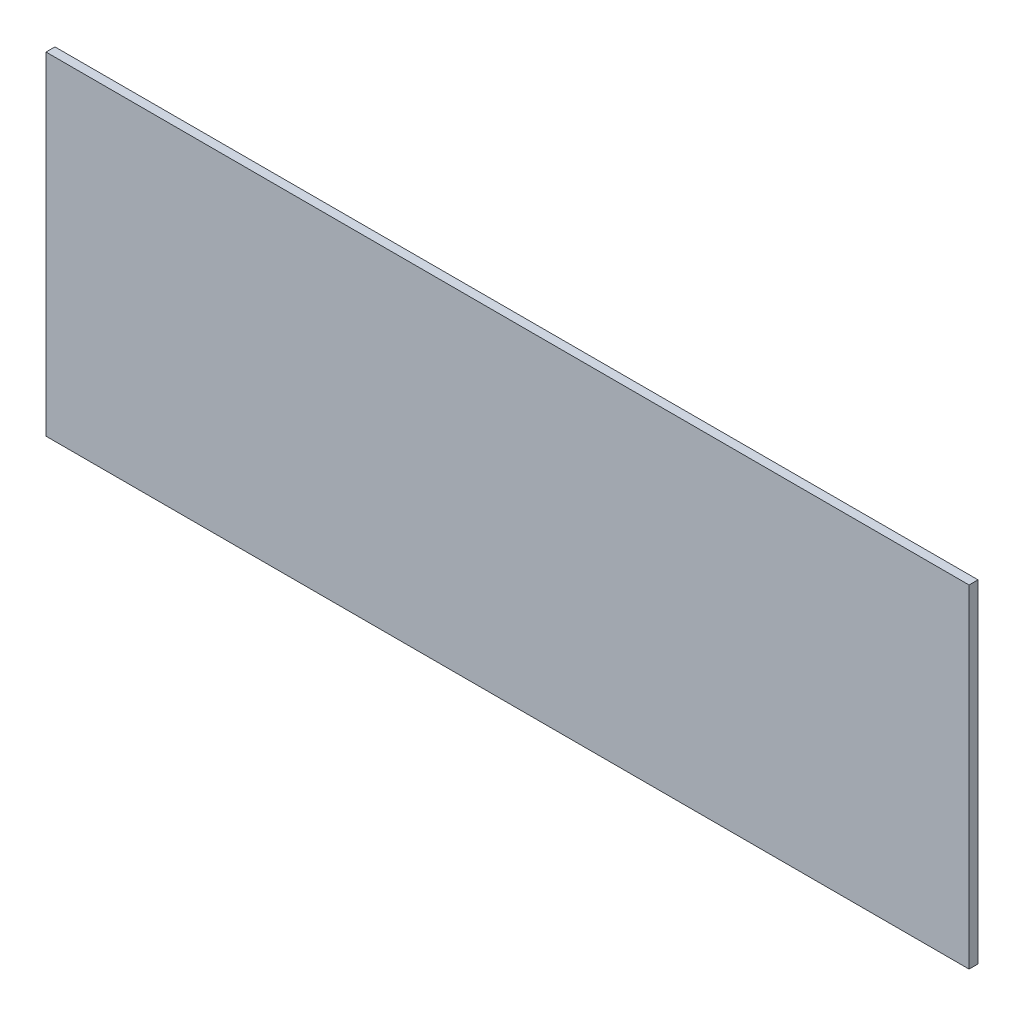
from build123d import *

# Parameters (mm, degrees)
SKETCH1_W           = 310
SKETCH1_H           = 111.736675057
BOSS_EXTRUDE1_DEPTH = 3


with BuildPart() as part:
    # Sketch1 → Boss-Extrude1 (new body)
    with BuildSketch(Plane.XY):
        with Locations((365, -29.978796833)):
            Rectangle(SKETCH1_W, SKETCH1_H)
    extrude(amount=BOSS_EXTRUDE1_DEPTH)


solid = part.part
